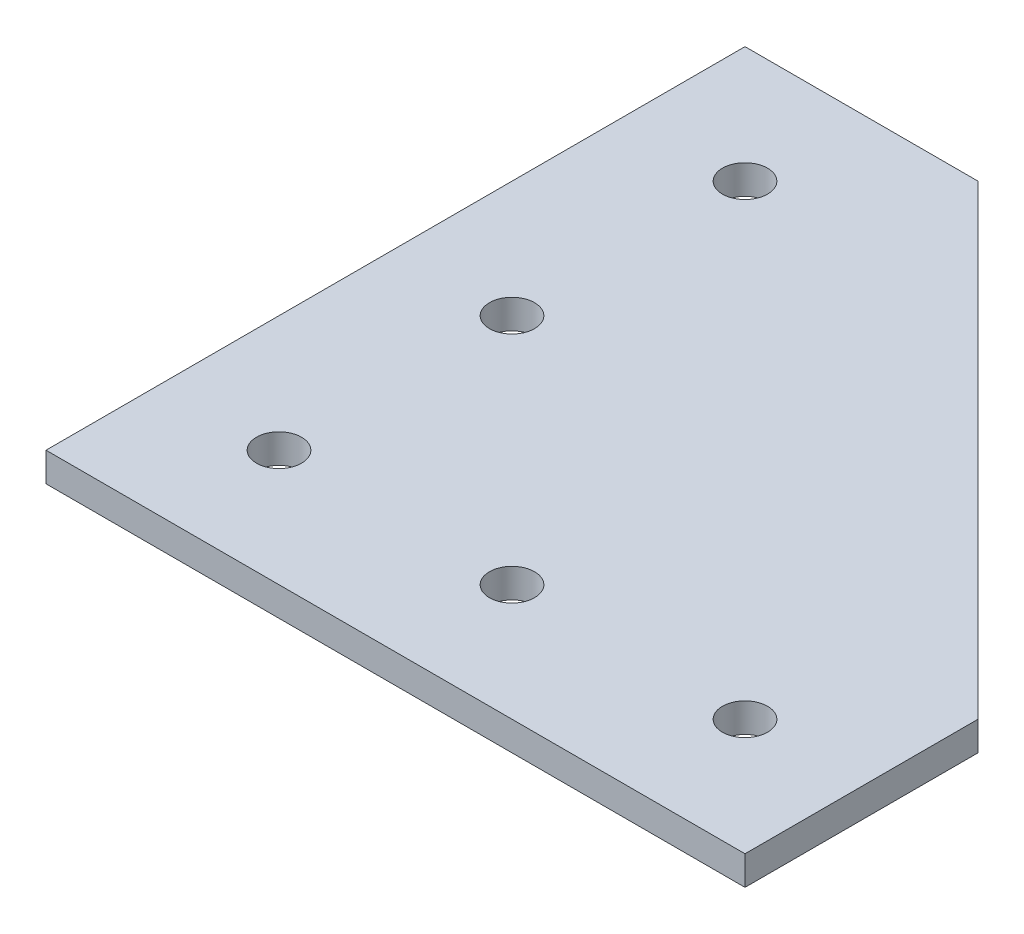
from build123d import *

# Parameters (mm, degrees)
BOSS_EXTRUDE1_DEPTH              = 3.175
F_10_0_1935_DIAMETER_HOLE1_D     = 4.9149
F_10_0_1935_DIAMETER_HOLE1_DEPTH = 25.4
F_10_0_1935_DIAMETER_HOLE1_TIP   = 1.476584928


with BuildPart() as part:
    # Sketch1 → Boss-Extrude1 (new body)
    with BuildSketch(Plane(origin=(0, 0, 0), x_dir=(1, 0, 0), z_dir=(0, 1, 0))):
        Polygon((0, 0), (0, 76.2), (25.4, 76.2), (76.2, 25.4), (76.2, 0), align=None)
    extrude(amount=BOSS_EXTRUDE1_DEPTH)

    # #10 (0.1935) Diameter Hole1
    with Locations(Plane(origin=(0, 0, 0), x_dir=(-1, 0, 0), z_dir=(0, -1, 0))):
        with Locations((-12.7, 12.7), (-12.7, 38.1), (-12.7, 63.5), (-38.1, 12.7), (-63.5, 12.7)):
            Hole(F_10_0_1935_DIAMETER_HOLE1_D / 2, depth=F_10_0_1935_DIAMETER_HOLE1_DEPTH)
            with Locations((0, 0, -(F_10_0_1935_DIAMETER_HOLE1_DEPTH + F_10_0_1935_DIAMETER_HOLE1_TIP / 2))):  # 118° drill point
                Cone(0, F_10_0_1935_DIAMETER_HOLE1_D / 2, F_10_0_1935_DIAMETER_HOLE1_TIP, mode=Mode.SUBTRACT)


solid = part.part
